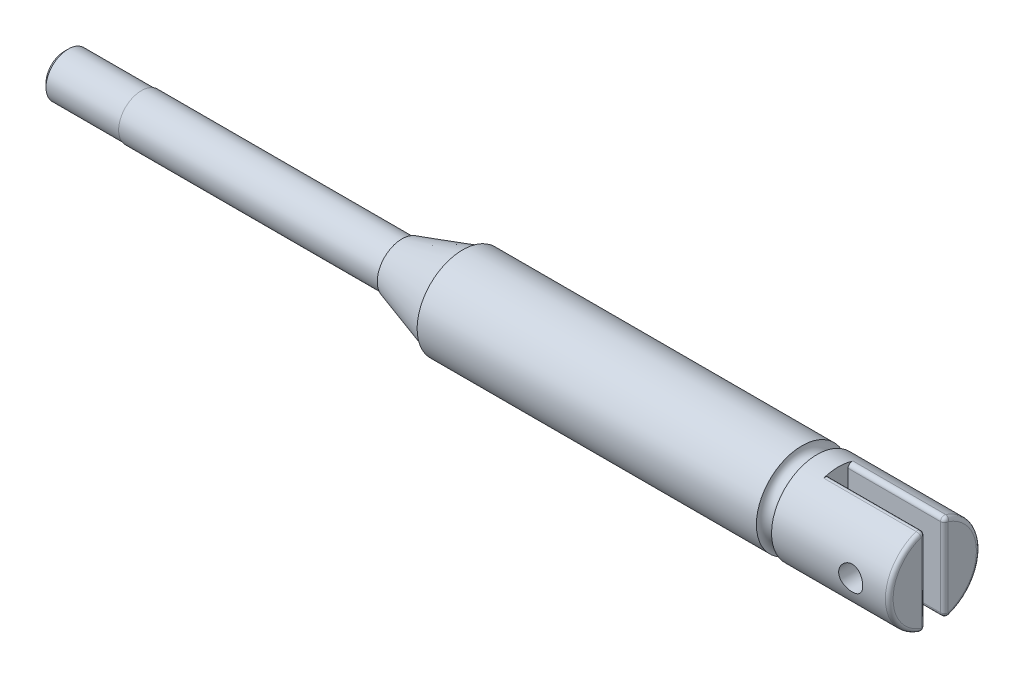
from build123d import *

# Parameters (mm, degrees)
ENL_V_MAT_EXTRU_1_DEPTH      = 58.525106762
ENL_V_MAT_EXTRU_1_DEPTH_BACK = 58.525106762
ESQUISSE2_W                  = 12.7
ESQUISSE2_H                  = 1.27
ENL_V_MAT_EXTRU_2_DEPTH      = 58.525106762
ENL_V_MAT_EXTRU_2_DEPTH_BACK = 58.525106762
ESQUISSE3_R                  = 0.79375
ESQUISSE4_W                  = 5.08
ESQUISSE4_H                  = 0.0395
CHANFREIN1_SIZE              = 0.254
CONG_1_R                     = 0.254
ESQUISSE5_R                  = 0.5


with BuildPart() as part:
    # Esquisse1 → Révolution1 (revolve)
    with BuildSketch(Plane.XY, mode=Mode.PRIVATE) as r_volution1_sk:
        Polygon((0, 0), (0, 3), (-31.115, 3), (-31.115, 2.873), (-35.114992, 1.627), (-35.114992, 1.5), (-57.36844, 1.5), (-57.36844, 0), align=None)
    revolve(r_volution1_sk.sketch.rotate(Axis((-76.031292341, 0, 0), (1, 0, 0)), 180), axis=Axis((-76.031292341, 0, 0), (1, 0, 0)))

    # Esquisse2 → Enlèv. mat.-Extru.1 (cut, two sides: drawn at the far end of the back side and taken through both)
    with BuildSketch(Plane(origin=(0, 0, 0), x_dir=(1, 0, 0), z_dir=(0, 1, 0)).offset(-ENL_V_MAT_EXTRU_1_DEPTH_BACK)):
        Rectangle(ESQUISSE2_W, ESQUISSE2_H)
    extrude(amount=ENL_V_MAT_EXTRU_1_DEPTH + ENL_V_MAT_EXTRU_1_DEPTH_BACK, mode=Mode.SUBTRACT)

    # Esquisse3 → Enlèv. mat.-Extru.2 (cut, two sides: drawn at the far end of the back side and taken through both)
    with BuildSketch(Plane.XY.offset(-ENL_V_MAT_EXTRU_2_DEPTH_BACK)):
        with Locations((-2.54, 0)):
            Circle(ESQUISSE3_R)
    extrude(amount=ENL_V_MAT_EXTRU_2_DEPTH + ENL_V_MAT_EXTRU_2_DEPTH_BACK, mode=Mode.SUBTRACT)

    # Esquisse4 → Enlèvement de matière-Révolution1 (revolve, cut)
    with BuildSketch(Plane.XY, mode=Mode.PRIVATE) as enl_vement_de_mati_re_r_volution1_sk:
        with Locations((-54.82844, 1.48025)):
            Rectangle(ESQUISSE4_W, ESQUISSE4_H)
    revolve(enl_vement_de_mati_re_r_volution1_sk.sketch.rotate(Axis((-63.433068243, 0, 0), (1, 0, 0)), 180), axis=Axis((-63.433068243, 0, 0), (1, 0, 0)), mode=Mode.SUBTRACT)

    # Chanfrein1
    chanfrein1_edges = [part.edges().sort_by_distance(p)[0] for p in [
        (-57.36844, 1.4605, 0),
    ]]
    chamfer(chanfrein1_edges, length=CHANFREIN1_SIZE)

    # Congé1
    cong_1_edges = [part.edges().sort_by_distance(p)[0] for p in [
        (0, 0, 3),
        (0, 0, -3),
        (0, 0, -0.635),
        (0, 0, 0.635),
        (-3.175, 2.93202575, 0.635),
        (-3.175, -2.93202575, 0.635),
        (-3.175, -2.93202575, -0.635),
        (-3.175, 2.93202575, -0.635),
    ]]
    fillet(cong_1_edges, radius=CONG_1_R)

    # Esquisse5 → Enlèvement de matière-Révolution2 (revolve, cut)
    with BuildSketch(Plane.XY, mode=Mode.PRIVATE) as enl_vement_de_mati_re_r_volution2_sk:
        with Locations((-8.255, 3)):
            Circle(ESQUISSE5_R)
    revolve(enl_vement_de_mati_re_r_volution2_sk.sketch.rotate(Axis((-76.031292341, 0, 0), (-1, 0, 0)), 180), axis=Axis((-76.031292341, 0, 0), (-1, 0, 0)), mode=Mode.SUBTRACT)


solid = part.part
